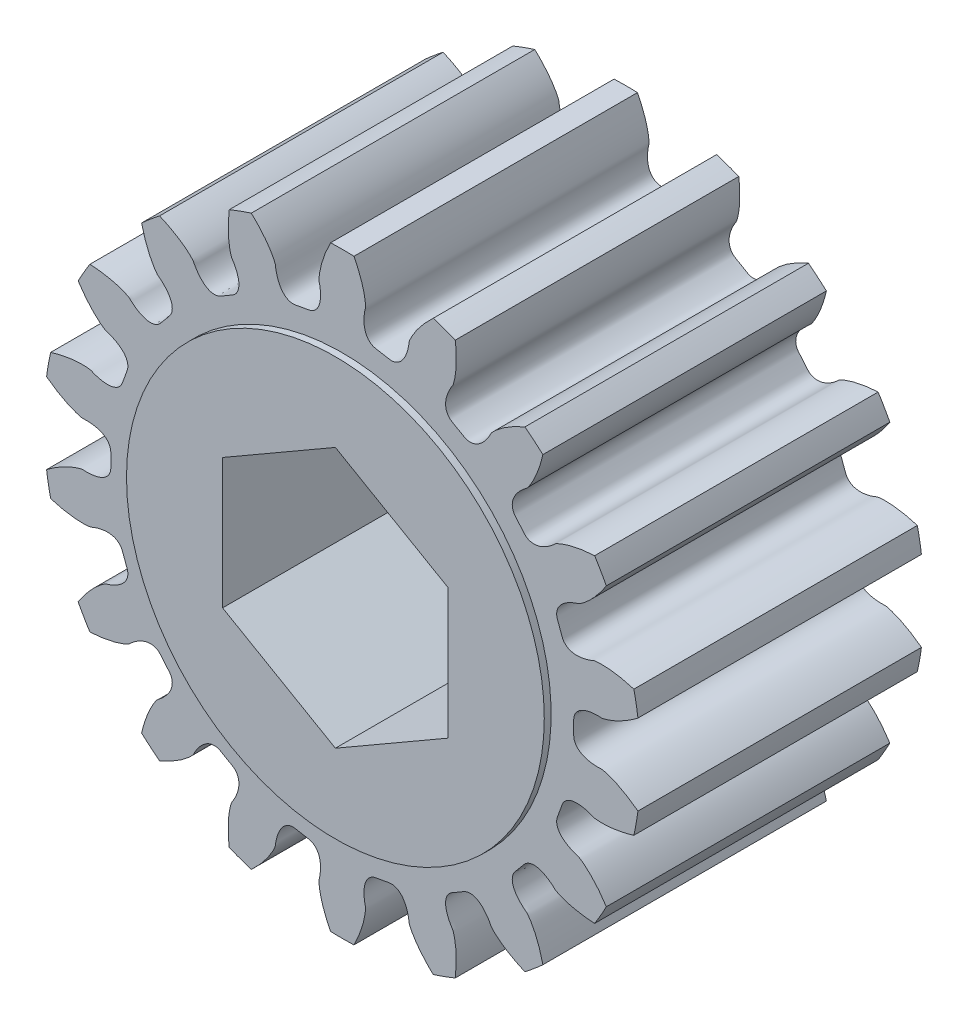
from build123d import *

# Parameters (mm, degrees)
BOSS_EXTRUDE1_DEPTH = 12.065
SKETCH2_R           = 8.89
BOSS_EXTRUDE2_DEPTH = 0.2921
BOSS_EXTRUDE3_START = 0.2921
SKETCH3_R           = 8.89
BOSS_EXTRUDE3_DEPTH = 0.2921
CUT_EXTRUDE1_DEPTH  = 22.900846166


with BuildPart() as part:
    # Sketch1 → Boss-Extrude1 (new body)
    with BuildSketch(Plane.XY.offset(6.0325)):
        with BuildLine():
            ThreePointArc((12.410970883, -2.694030306), (12.507058369, -2.205331838), (12.583910389, -1.713241638))
            add(Edge.make_bspline(
                [(12.583910389, -1.713241638), (12.454495513, -1.615266365), (12.281691884, -1.494600081), (12.063530587, -1.360821083), (11.945634884, -1.293014345), (11.833605036, -1.232708673), (11.727763905, -1.179517154), (11.628417021, -1.133040061), (11.535852234, -1.09286743), (11.450339429, -1.058575143), (11.372129731, -1.029740178), (11.301456539, -1.005894736), (11.238530851, -0.986673766), (11.183554417, -0.971362731), (11.126066888, -0.957744243), (11.037383924, -0.935500863), (10.935383555, -0.952855993), (10.832757273, -0.948980949), (10.755684694, -0.945835715), (10.681454151, -0.939599556), (10.609986165, -0.931080188), (10.541241018, -0.920104184), (10.475144099, -0.906715101), (10.411601978, -0.890856967), (10.350496087, -0.872438809), (10.291684118, -0.851296022), (10.23500406, -0.827170041), (10.180287123, -0.799673241), (10.127386898, -0.768246797), (10.076238411, -0.732113156), (10.026966573, -0.690238537), (9.98006979, -0.641341891), (9.936675165, -0.584030203), (9.898843597, -0.517153755), (9.869552788, -0.440522263), (9.854050846, -0.362318712), (9.847049326, -0.214546824), (9.861767648, -5e-09), (9.847049326, 0.214546814), (9.854050846, 0.362318702), (9.869552789, 0.440522252), (9.898843597, 0.517153744), (9.936675165, 0.584030193), (9.980069791, 0.641341881), (10.026966574, 0.690238527), (10.076238412, 0.732113146), (10.127386899, 0.768246787), (10.180287124, 0.79967323), (10.235004061, 0.82717003), (10.291684119, 0.851296011), (10.350496088, 0.872438798), (10.411601979, 0.890856956), (10.4751441, 0.90671509), (10.541241019, 0.920104174), (10.609986166, 0.931080178), (10.681454152, 0.939599545), (10.755684695, 0.945835704), (10.832757274, 0.948980938), (10.935383556, 0.952855982), (11.037383925, 0.935500852), (11.126066889, 0.957744232), (11.183554418, 0.97136272), (11.238530852, 0.986673755), (11.30145654, 1.005894724), (11.372129732, 1.029740166), (11.45033943, 1.058575132), (11.535852235, 1.092867418), (11.628417022, 1.133040049), (11.727763907, 1.179517142), (11.833605037, 1.23270866), (11.945634885, 1.293014333), (12.063530588, 1.360821071), (12.281691885, 1.494600068), (12.454495515, 1.615266353), (12.58391039, 1.713241625)],
                knots=[0, 0, 0, 0, 0.068568258, 0.088954796, 0.108105787, 0.12602123, 0.142701125, 0.158145472, 0.172354272, 0.185327523, 0.197065227, 0.207567384, 0.216833992, 0.224865053, 0.231660567, 0.241835881, 0.263155637, 0.274398239, 0.285253325, 0.295735543, 0.30586243, 0.315655123, 0.325139277, 0.334346238, 0.343314557, 0.352091904, 0.360737466, 0.369324816, 0.377945084, 0.386709838, 0.395752205, 0.405223204, 0.415278018, 0.42604547, 0.437577809, 0.44979349, 0.459544035, 0.500000005, 0.540455975, 0.550206519, 0.5624222, 0.573954539, 0.584721991, 0.594776805, 0.604247805, 0.613290172, 0.622054925, 0.630675194, 0.639262544, 0.647908106, 0.656685453, 0.665653771, 0.674860733, 0.684344886, 0.69413758, 0.704264467, 0.714746685, 0.725601771, 0.736844372, 0.758164128, 0.768339443, 0.775134956, 0.783166017, 0.792432626, 0.802934782, 0.814672486, 0.827645738, 0.841854537, 0.857298885, 0.87397878, 0.891894222, 0.911045213, 0.931431751, 1.000000005, 1.000000005, 1.000000005, 1.000000005], degree=3))
            ThreePointArc((12.58391039, 1.713241625), (12.507058371, 2.205331832), (12.410970883, 2.694030306))
            add(Edge.make_bspline(
                [(12.410970883, 2.694030306), (12.255851163, 2.741834452), (12.052198568, 2.796121347), (11.801438895, 2.847216926), (11.667461903, 2.870611712), (11.541562526, 2.888964043), (11.423911826, 2.902747921), (11.31466019, 2.912443467), (11.213937893, 2.91853437), (11.121853489, 2.921511477), (11.038498274, 2.921858189), (10.963931576, 2.92009392), (10.898226812, 2.91663387), (10.84132918, 2.912218489), (10.782650776, 2.905353789), (10.691708366, 2.895924368), (10.601795176, 2.8447297), (10.504032672, 2.813270795), (10.430532405, 2.789865973), (10.35864562, 2.770337704), (10.288573885, 2.7538998), (10.220220564, 2.740701645), (10.153530441, 2.730676791), (10.088396577, 2.723845877), (10.024676441, 2.720253838), (9.962180009, 2.720006681), (9.900666605, 2.723291966), (9.839845043, 2.730416211), (9.779386616, 2.741854465), (9.718964327, 2.758315169), (9.658341981, 2.780812478), (9.597549782, 2.810720651), (9.537170421, 2.849734185), (9.478747284, 2.899638332), (9.425013413, 2.961630333), (9.383699162, 3.029815656), (9.326578923, 3.166281147), (9.267030288, 3.372923173), (9.179820255, 3.569497273), (9.13585857, 3.710752086), (9.123678441, 3.789541362), (9.124993284, 3.871569456), (9.137670236, 3.94735192), (9.158846094, 4.016049126), (9.186191017, 4.078036588), (9.218169437, 4.13423782), (9.253874859, 4.185686149), (9.292836333, 4.233310288), (9.334848976, 4.277863123), (9.379859237, 4.319919851), (9.427893151, 4.359902449), (9.479014525, 4.398109302), (9.533300786, 4.434743759), (9.590832237, 4.46993186), (9.651677529, 4.503758155), (9.715921673, 4.536207233), (9.783542674, 4.567455646), (9.854891475, 4.596771573), (9.950003292, 4.63551318), (10.05178809, 4.654090873), (10.127515133, 4.705324173), (10.176877942, 4.737783259), (10.223302209, 4.770973973), (10.275859055, 4.810557629), (10.33411451, 4.85713667), (10.397745447, 4.910981967), (10.466372546, 4.972453278), (10.539615145, 5.041862224), (10.617074577, 5.119515041), (10.698340136, 5.205698517), (10.782988003, 5.300683777), (10.870582454, 5.404723974), (11.029831903, 5.605050669), (11.150943898, 5.777542208), (11.239044585, 5.913871343)],
                knots=[0, 0, 0, 0, 0.068568258, 0.088954796, 0.108105787, 0.12602123, 0.142701125, 0.158145472, 0.172354272, 0.185327523, 0.197065227, 0.207567384, 0.216833992, 0.224865053, 0.231660567, 0.241835881, 0.263155637, 0.274398239, 0.285253325, 0.295735543, 0.30586243, 0.315655123, 0.325139277, 0.334346238, 0.343314557, 0.352091904, 0.360737466, 0.369324816, 0.377945084, 0.386709838, 0.395752205, 0.405223204, 0.415278018, 0.42604547, 0.437577809, 0.44979349, 0.459544035, 0.500000005, 0.540455975, 0.550206519, 0.5624222, 0.573954539, 0.584721991, 0.594776805, 0.604247805, 0.613290172, 0.622054925, 0.630675194, 0.639262544, 0.647908106, 0.656685453, 0.665653771, 0.674860733, 0.684344886, 0.69413758, 0.704264467, 0.714746685, 0.725601771, 0.736844372, 0.758164128, 0.768339443, 0.775134956, 0.783166017, 0.792432626, 0.802934782, 0.814672486, 0.827645738, 0.841854537, 0.857298885, 0.87397878, 0.891894222, 0.911045213, 0.931431751, 1.000000005, 1.000000005, 1.000000005, 1.000000005], degree=3))
            ThreePointArc((11.239044585, 5.913871343), (10.998522549, 6.349999934), (10.741085127, 6.776362423))
            add(Edge.make_bspline(
                [(10.741085127, 6.776362423), (10.57897029, 6.768229557), (10.369032237, 6.749589262), (10.115919506, 6.711838541), (9.982020827, 6.687999619), (9.857437245, 6.662185046), (9.742167386, 6.634898745), (9.636188358, 6.606643318), (9.539457148, 6.57791784), (9.451907882, 6.549220684), (9.373461019, 6.521037324), (9.303994658, 6.493876141), (9.243435784, 6.468152405), (9.191479648, 6.444543168), (9.138687851, 6.418023263), (9.05645499, 6.378058371), (8.989473837, 6.299198996), (8.908366713, 6.23620055), (8.847303975, 6.189068639), (8.786431555, 6.146131341), (8.726207757, 6.106718819), (8.66649068, 6.070938398), (8.607251166, 6.03870875), (8.548381665, 6.010012697), (8.489732872, 5.984843715), (8.431089969, 5.963236424), (8.372162644, 5.945284759), (8.312572436, 5.931177161), (8.251847984, 5.921247604), (8.189439713, 5.916049966), (8.124778809, 5.916456458), (8.057423631, 5.92376879), (7.987342176, 5.939778563), (7.915374162, 5.966691232), (7.843678327, 6.006566591), (7.781534876, 6.05650953), (7.681185462, 6.165208873), (7.554552314, 6.339022027), (7.405369388, 6.49391367), (7.315746925, 6.611613994), (7.277353829, 6.681485846), (7.250534116, 6.759016743), (7.236527426, 6.834564738), (7.232930395, 6.906361566), (7.237425257, 6.97396324), (7.248253188, 7.037712387), (7.264208945, 7.098269976), (7.28453234, 7.156347637), (7.308773343, 7.212582777), (7.336684905, 7.26749759), (7.368147166, 7.321497509), (7.40311803, 7.374884747), (7.441600707, 7.42787687), (7.483627548, 7.480619784), (7.529234146, 7.533216419), (7.578505655, 7.58568137), (7.631361024, 7.638173018), (7.688380328, 7.690123705), (7.764505791, 7.759059064), (7.85379827, 7.811328837), (7.907435592, 7.885372565), (7.942719799, 7.932757203), (7.974992447, 7.979824307), (8.010841319, 8.034996277), (8.04965257, 8.098690797), (8.091029917, 8.171051887), (8.134493868, 8.252287874), (8.17958014, 8.342561393), (8.225809369, 8.442023858), (8.27269753, 8.550804293), (8.319753634, 8.669012516), (8.36648165, 8.796737388), (8.447611417, 9.039449425), (8.502423885, 9.242961193), (8.53858414, 9.401200885)],
                knots=[0, 0, 0, 0, 0.068568258, 0.088954796, 0.108105787, 0.12602123, 0.142701125, 0.158145472, 0.172354272, 0.185327523, 0.197065227, 0.207567384, 0.216833992, 0.224865053, 0.231660567, 0.241835881, 0.263155637, 0.274398239, 0.285253325, 0.295735543, 0.30586243, 0.315655123, 0.325139277, 0.334346238, 0.343314557, 0.352091904, 0.360737466, 0.369324816, 0.377945084, 0.386709838, 0.395752205, 0.405223204, 0.415278018, 0.42604547, 0.437577809, 0.44979349, 0.459544035, 0.500000005, 0.540455975, 0.550206519, 0.5624222, 0.573954539, 0.584721991, 0.594776805, 0.604247805, 0.613290172, 0.622054925, 0.630675194, 0.639262544, 0.647908106, 0.656685453, 0.665653771, 0.674860733, 0.684344886, 0.69413758, 0.704264467, 0.714746685, 0.725601771, 0.736844372, 0.758164128, 0.768339443, 0.775134956, 0.783166017, 0.792432626, 0.802934782, 0.814672486, 0.827645738, 0.841854537, 0.857298885, 0.87397878, 0.891894222, 0.911045213, 0.931431751, 1.000000005, 1.000000005, 1.000000005, 1.000000005], degree=3))
            ThreePointArc((8.53858414, 9.401200885), (8.163402594, 9.728764322), (7.775665989, 10.041365223))
            add(Edge.make_bspline(
                [(7.775665989, 10.041365223), (7.626109477, 9.978276289), (7.435207594, 9.888957098), (7.210270936, 9.766913371), (7.092600726, 9.698716067), (6.984359558, 9.631848209), (6.885373786, 9.56678286), (6.795450001, 9.503984481), (6.714377089, 9.443907339), (6.641922695, 9.386997221), (6.577846033, 9.333683118), (6.521858679, 9.28440106), (6.473749987, 9.2395163), (6.433002025, 9.199560829), (6.392464304, 9.156584413), (6.32885949, 9.090904403), (6.292889289, 8.993891927), (6.238220261, 8.906952482), (6.196960119, 8.841778287), (6.154444176, 8.780610831), (6.111332194, 8.722977423), (6.067454122, 8.668930382), (6.022810376, 8.618383312), (5.977305769, 8.571283288), (5.93080223, 8.527573113), (5.883086055, 8.487211847), (5.833852314, 8.450188467), (5.782680918, 8.41655061), (5.729014708, 8.386450893), (5.672147813, 8.360221825), (5.61124741, 8.338488471), (5.545453281, 8.322322988), (5.47412259, 8.313397984), (5.397290103, 8.31407311), (5.31627988, 8.327022271), (5.240802647, 8.352698971), (5.109327678, 8.42052142), (4.930883844, 8.54054127), (4.737721687, 8.635068239), (4.613248238, 8.715017677), (4.553272948, 8.767544528), (4.501553533, 8.831226859), (4.462552614, 8.897428182), (4.434616549, 8.963664873), (4.415719203, 9.028727002), (4.404090638, 9.092334975), (4.39837223, 9.154697685), (4.397606244, 9.216223845), (4.401151785, 9.277358502), (4.408598102, 9.338507863), (4.419693896, 9.400011916), (4.434296249, 9.462140249), (4.452333762, 9.525098407), (4.473786935, 9.58903456), (4.49865401, 9.654057605), (4.527010014, 9.720210381), (4.558724614, 9.787613996), (4.594537051, 9.855933424), (4.642494306, 9.946747914), (4.708524474, 10.02640526), (4.733602623, 10.114328649), (4.750552431, 10.170923554), (4.764780903, 10.22619006), (4.779597899, 10.290295789), (4.794283736, 10.363423289), (4.808416773, 10.445572357), (4.821475183, 10.536774762), (4.832967058, 10.637024535), (4.842390157, 10.746300007), (4.849245516, 10.864556874), (4.853034196, 10.991730405), (4.853259689, 11.127734447), (4.846484327, 11.383557171), (4.828386074, 11.593542647), (4.808244437, 11.754606853)],
                knots=[0, 0, 0, 0, 0.068568258, 0.088954796, 0.108105787, 0.12602123, 0.142701125, 0.158145472, 0.172354272, 0.185327523, 0.197065227, 0.207567384, 0.216833992, 0.224865053, 0.231660567, 0.241835881, 0.263155637, 0.274398239, 0.285253325, 0.295735543, 0.30586243, 0.315655123, 0.325139277, 0.334346238, 0.343314557, 0.352091904, 0.360737466, 0.369324816, 0.377945084, 0.386709838, 0.395752205, 0.405223204, 0.415278018, 0.42604547, 0.437577809, 0.44979349, 0.459544035, 0.500000005, 0.540455975, 0.550206519, 0.5624222, 0.573954539, 0.584721991, 0.594776805, 0.604247805, 0.613290172, 0.622054925, 0.630675194, 0.639262544, 0.647908106, 0.656685453, 0.665653771, 0.674860733, 0.684344886, 0.69413758, 0.704264467, 0.714746685, 0.725601771, 0.736844372, 0.758164128, 0.768339443, 0.775134956, 0.783166017, 0.792432626, 0.802934782, 0.814672486, 0.827645738, 0.841854537, 0.857298885, 0.87397878, 0.891894222, 0.911045213, 0.931431751, 1.000000005, 1.000000005, 1.000000005, 1.000000005], degree=3))
            ThreePointArc((4.808244437, 11.754606853), (4.343655813, 11.934096152), (3.872386782, 12.095231182))
            add(Edge.make_bspline(
                [(3.872386782, 12.095231182), (3.753427317, 11.984795637), (3.604587189, 11.835570763), (3.434957284, 11.643954305), (3.347708308, 11.53962422), (3.268865036, 11.439768327), (3.198102496, 11.344771771), (3.13508009, 11.255004851), (3.079444065, 11.170822235), (3.030823612, 11.092563355), (2.988845743, 11.020548977), (2.953090296, 10.955090188), (2.923234405, 10.896458169), (2.898609422, 10.844975684), (2.875215224, 10.790726345), (2.837910136, 10.707253197), (2.837289425, 10.603788756), (2.815652384, 10.503394492), (2.799171421, 10.428038982), (2.780140005, 10.356019066), (2.75933978, 10.287116212), (2.736593057, 10.221321422), (2.711929774, 10.158553653), (2.685278587, 10.098730616), (2.656529316, 10.04175134), (2.625495144, 9.987504263), (2.591893302, 9.935874735), (2.555312744, 9.886763841), (2.515177711, 9.840124434), (2.47071118, 9.796027549), (2.420916765, 9.754775711), (2.364619428, 9.717082209), (2.300643036, 9.684298916), (2.228213209, 9.658655068), (2.147659626, 9.643116171), (2.067952278, 9.641429642), (1.921209576, 9.66019481), (1.712478015, 9.711945192), (1.498634835, 9.734706138), (1.354323736, 9.767261608), (1.280000156, 9.796107945), (1.209619164, 9.83826068), (1.150328102, 9.887130474), (1.101422505, 9.939817908), (1.06141225, 9.994493037), (1.028729765, 10.050287777), (1.002026917, 10.106933744), (0.980263939, 10.16448744), (0.962686374, 10.223147873), (0.948769309, 10.283156266), (0.93816032, 10.344746156), (0.930632902, 10.408121991), (0.926049662, 10.4734525), (0.924341599, 10.540870249), (0.925469814, 10.610476965), (0.92949016, 10.682338565), (0.936238741, 10.756524276), (0.946524804, 10.832972114), (0.960529497, 10.934712167), (0.995333141, 11.032149235), (0.988827324, 11.123347427), (0.985398336, 11.182326417), (0.979866467, 11.239126369), (0.971864438, 11.30443376), (0.960653533, 11.378173985), (0.945837607, 11.460202641), (0.92691544, 11.550371108), (0.903426828, 11.648505532), (0.874907232, 11.754413776), (0.840902932, 11.867883553), (0.800967217, 11.988683386), (0.754662989, 12.116562504), (0.660799707, 12.35463992), (0.571973649, 12.545771754), (0.497959499, 12.690233755)],
                knots=[0, 0, 0, 0, 0.068568258, 0.088954796, 0.108105787, 0.12602123, 0.142701125, 0.158145472, 0.172354272, 0.185327523, 0.197065227, 0.207567384, 0.216833992, 0.224865053, 0.231660567, 0.241835881, 0.263155637, 0.274398239, 0.285253325, 0.295735543, 0.30586243, 0.315655123, 0.325139277, 0.334346238, 0.343314557, 0.352091904, 0.360737466, 0.369324816, 0.377945084, 0.386709838, 0.395752205, 0.405223204, 0.415278018, 0.42604547, 0.437577809, 0.44979349, 0.459544035, 0.500000005, 0.540455975, 0.550206519, 0.5624222, 0.573954539, 0.584721991, 0.594776805, 0.604247805, 0.613290172, 0.622054925, 0.630675194, 0.639262544, 0.647908106, 0.656685453, 0.665653771, 0.674860733, 0.684344886, 0.69413758, 0.704264467, 0.714746685, 0.725601771, 0.736844372, 0.758164128, 0.768339443, 0.775134956, 0.783166017, 0.792432626, 0.802934782, 0.814672486, 0.827645738, 0.841854537, 0.857298885, 0.87397878, 0.891894222, 0.911045213, 0.931431751, 1.000000005, 1.000000005, 1.000000005, 1.000000005], degree=3))
            ThreePointArc((0.497959499, 12.690233755), (4.2e-08, 12.699999857), (-0.497959416, 12.690233754))
            add(Edge.make_bspline(
                [(-0.497959416, 12.690233754), (-0.571973566, 12.545771754), (-0.660799623, 12.354639919), (-0.754662905, 12.116562503), (-0.800967133, 11.988683385), (-0.840902847, 11.867883552), (-0.874907148, 11.754413776), (-0.903426744, 11.648505531), (-0.926915355, 11.550371107), (-0.945837523, 11.46020264), (-0.960653449, 11.378173984), (-0.971864354, 11.304433759), (-0.979866382, 11.239126368), (-0.985398251, 11.182326416), (-0.988827239, 11.123347426), (-0.995333057, 11.032149233), (-0.960529412, 10.934712166), (-0.946524718, 10.832972113), (-0.936238656, 10.756524275), (-0.929490075, 10.682338564), (-0.925469729, 10.610476964), (-0.924341513, 10.540870248), (-0.926049577, 10.473452499), (-0.930632816, 10.40812199), (-0.938160235, 10.344746155), (-0.948769224, 10.283156265), (-0.962686288, 10.223147872), (-0.980263854, 10.164487439), (-1.002026831, 10.106933743), (-1.028729679, 10.050287776), (-1.061412164, 9.994493036), (-1.101422419, 9.939817907), (-1.150328016, 9.887130473), (-1.209619078, 9.838260679), (-1.28000007, 9.796107944), (-1.354323649, 9.767261607), (-1.498634749, 9.734706137), (-1.712477929, 9.71194519), (-1.92120949, 9.660194808), (-2.067952192, 9.64142964), (-2.147659539, 9.643116169), (-2.228213122, 9.658655066), (-2.30064295, 9.684298913), (-2.364619342, 9.717082207), (-2.420916679, 9.754775709), (-2.470711094, 9.796027546), (-2.515177625, 9.840124431), (-2.555312658, 9.886763838), (-2.591893216, 9.935874733), (-2.625495058, 9.987504261), (-2.65652923, 10.041751337), (-2.685278501, 10.098730613), (-2.711929688, 10.158553651), (-2.736592971, 10.221321419), (-2.759339694, 10.287116209), (-2.78013992, 10.356019063), (-2.799171336, 10.42803898), (-2.815652299, 10.503394489), (-2.837289339, 10.603788753), (-2.837910051, 10.707253194), (-2.875215139, 10.790726342), (-2.898609336, 10.844975681), (-2.92323432, 10.896458166), (-2.953090211, 10.955090185), (-2.988845658, 11.020548974), (-3.030823527, 11.092563352), (-3.07944398, 11.170822232), (-3.135080005, 11.255004848), (-3.198102412, 11.344771768), (-3.268864951, 11.439768323), (-3.347708224, 11.539624216), (-3.434957199, 11.643954302), (-3.604587105, 11.835570759), (-3.753427233, 11.984795633), (-3.872386698, 12.095231178)],
                knots=[0, 0, 0, 0, 0.068568258, 0.088954796, 0.108105787, 0.12602123, 0.142701125, 0.158145472, 0.172354272, 0.185327523, 0.197065227, 0.207567384, 0.216833992, 0.224865053, 0.231660567, 0.241835881, 0.263155637, 0.274398239, 0.285253325, 0.295735543, 0.30586243, 0.315655123, 0.325139277, 0.334346238, 0.343314557, 0.352091904, 0.360737466, 0.369324816, 0.377945084, 0.386709838, 0.395752205, 0.405223204, 0.415278018, 0.42604547, 0.437577809, 0.44979349, 0.459544035, 0.500000005, 0.540455975, 0.550206519, 0.5624222, 0.573954539, 0.584721991, 0.594776805, 0.604247805, 0.613290172, 0.622054925, 0.630675194, 0.639262544, 0.647908106, 0.656685453, 0.665653771, 0.674860733, 0.684344886, 0.69413758, 0.704264467, 0.714746685, 0.725601771, 0.736844372, 0.758164128, 0.768339443, 0.775134956, 0.783166017, 0.792432626, 0.802934782, 0.814672486, 0.827645738, 0.841854537, 0.857298885, 0.87397878, 0.891894222, 0.911045213, 0.931431751, 1.000000005, 1.000000005, 1.000000005, 1.000000005], degree=3))
            ThreePointArc((-3.872386698, 12.095231178), (-4.343655729, 11.934096147), (-4.808244353, 11.754606848))
            add(Edge.make_bspline(
                [(-4.808244353, 11.754606848), (-4.82838599, 11.593542642), (-4.846484243, 11.383557166), (-4.853259604, 11.127734442), (-4.853034111, 10.9917304), (-4.849245431, 10.864556869), (-4.842390072, 10.746300002), (-4.832966973, 10.63702453), (-4.821475098, 10.536774757), (-4.808416687, 10.445572352), (-4.794283651, 10.363423284), (-4.779597813, 10.290295784), (-4.764780817, 10.226190055), (-4.750552345, 10.170923549), (-4.733602538, 10.114328644), (-4.708524388, 10.026405255), (-4.64249422, 9.946747909), (-4.594536965, 9.855933419), (-4.558724527, 9.787613991), (-4.527009928, 9.720210376), (-4.498653924, 9.6540576), (-4.473786849, 9.589034555), (-4.452333676, 9.525098402), (-4.434296162, 9.462140244), (-4.419693809, 9.400011911), (-4.408598015, 9.338507859), (-4.401151699, 9.277358498), (-4.397606157, 9.21622384), (-4.398372143, 9.15469768), (-4.404090551, 9.092334971), (-4.415719116, 9.028726997), (-4.434616462, 8.963664869), (-4.462552527, 8.897428177), (-4.501553446, 8.831226854), (-4.553272861, 8.767544524), (-4.613248151, 8.715017672), (-4.7377216, 8.635068234), (-4.930883756, 8.540541265), (-5.109327591, 8.420521415), (-5.240802559, 8.352698965), (-5.316279792, 8.327022266), (-5.397290015, 8.314073104), (-5.474122503, 8.313397978), (-5.545453193, 8.322322982), (-5.611247322, 8.338488465), (-5.672147725, 8.360221819), (-5.72901462, 8.386450887), (-5.78268083, 8.416550604), (-5.833852226, 8.450188461), (-5.883085968, 8.487211841), (-5.930802143, 8.527573107), (-5.977305681, 8.571283282), (-6.022810289, 8.618383306), (-6.067454035, 8.668930375), (-6.111332106, 8.722977417), (-6.154444089, 8.780610824), (-6.196960032, 8.84177828), (-6.238220174, 8.906952475), (-6.292889201, 8.993891921), (-6.328859403, 9.090904397), (-6.392464217, 9.156584406), (-6.433001938, 9.199560823), (-6.4737499, 9.239516293), (-6.521858592, 9.284401053), (-6.577845946, 9.333683111), (-6.641922608, 9.386997214), (-6.714377002, 9.443907332), (-6.795449914, 9.503984474), (-6.8853737, 9.566782853), (-6.984359472, 9.631848201), (-7.09260064, 9.69871606), (-7.210270849, 9.766913364), (-7.435207508, 9.88895709), (-7.626109391, 9.978276281), (-7.775665903, 10.041365215)],
                knots=[0, 0, 0, 0, 0.068568258, 0.088954796, 0.108105787, 0.12602123, 0.142701125, 0.158145472, 0.172354272, 0.185327523, 0.197065227, 0.207567384, 0.216833992, 0.224865053, 0.231660567, 0.241835881, 0.263155637, 0.274398239, 0.285253325, 0.295735543, 0.30586243, 0.315655123, 0.325139277, 0.334346238, 0.343314557, 0.352091904, 0.360737466, 0.369324816, 0.377945084, 0.386709838, 0.395752205, 0.405223204, 0.415278018, 0.42604547, 0.437577809, 0.44979349, 0.459544035, 0.500000005, 0.540455975, 0.550206519, 0.5624222, 0.573954539, 0.584721991, 0.594776805, 0.604247805, 0.613290172, 0.622054925, 0.630675194, 0.639262544, 0.647908106, 0.656685453, 0.665653771, 0.674860733, 0.684344886, 0.69413758, 0.704264467, 0.714746685, 0.725601771, 0.736844372, 0.758164128, 0.768339443, 0.775134956, 0.783166017, 0.792432626, 0.802934782, 0.814672486, 0.827645738, 0.841854537, 0.857298885, 0.87397878, 0.891894222, 0.911045213, 0.931431751, 1.000000005, 1.000000005, 1.000000005, 1.000000005], degree=3))
            ThreePointArc((-7.775665903, 10.041365215), (-8.163402508, 9.728764314), (-8.538584053, 9.401200876))
            add(Edge.make_bspline(
                [(-8.538584053, 9.401200876), (-8.502423798, 9.242961184), (-8.44761133, 9.039449416), (-8.366481563, 8.79673738), (-8.319753546, 8.669012508), (-8.272697442, 8.550804284), (-8.225809282, 8.44202385), (-8.179580052, 8.342561384), (-8.13449378, 8.252287866), (-8.091029829, 8.171051878), (-8.049652482, 8.098690788), (-8.010841231, 8.034996268), (-7.974992359, 7.979824299), (-7.942719711, 7.932757195), (-7.907435504, 7.885372557), (-7.853798181, 7.811328829), (-7.764505703, 7.759059056), (-7.68838024, 7.690123697), (-7.631360936, 7.63817301), (-7.578505567, 7.585681362), (-7.529234057, 7.533216411), (-7.483627459, 7.480619776), (-7.441600618, 7.427876863), (-7.403117941, 7.374884739), (-7.368147077, 7.321497502), (-7.336684816, 7.267497582), (-7.308773254, 7.21258277), (-7.284532251, 7.15634763), (-7.264208856, 7.098269968), (-7.248253099, 7.03771238), (-7.237425168, 6.973963233), (-7.232930305, 6.906361558), (-7.236527337, 6.834564731), (-7.250534027, 6.759016736), (-7.277353739, 6.681485838), (-7.315746836, 6.611613986), (-7.405369299, 6.493913663), (-7.554552225, 6.339022019), (-7.681185372, 6.165208865), (-7.781534786, 6.056509522), (-7.843678237, 6.006566583), (-7.915374072, 5.966691223), (-7.987342086, 5.939778555), (-8.057423541, 5.923768782), (-8.124778719, 5.916456449), (-8.189439623, 5.916049957), (-8.251847894, 5.921247596), (-8.312572346, 5.931177152), (-8.372162554, 5.94528475), (-8.431089879, 5.963236416), (-8.489732782, 5.984843706), (-8.548381574, 6.010012688), (-8.607251076, 6.038708741), (-8.66649059, 6.070938389), (-8.726207667, 6.10671881), (-8.786431465, 6.146131332), (-8.847303885, 6.18906863), (-8.908366623, 6.236200541), (-8.989473747, 6.299198987), (-9.056454901, 6.378058361), (-9.138687761, 6.418023254), (-9.191479559, 6.444543158), (-9.243435694, 6.468152395), (-9.303994569, 6.493876131), (-9.373460929, 6.521037315), (-9.451907792, 6.549220675), (-9.539457058, 6.57791783), (-9.636188269, 6.606643308), (-9.742167297, 6.634898735), (-9.857437156, 6.662185035), (-9.982020738, 6.687999609), (-10.115919417, 6.71183853), (-10.369032148, 6.749589251), (-10.578970201, 6.768229546), (-10.741085038, 6.776362412)],
                knots=[0, 0, 0, 0, 0.068568258, 0.088954796, 0.108105787, 0.12602123, 0.142701125, 0.158145472, 0.172354272, 0.185327523, 0.197065227, 0.207567384, 0.216833992, 0.224865053, 0.231660567, 0.241835881, 0.263155637, 0.274398239, 0.285253325, 0.295735543, 0.30586243, 0.315655123, 0.325139277, 0.334346238, 0.343314557, 0.352091904, 0.360737466, 0.369324816, 0.377945084, 0.386709838, 0.395752205, 0.405223204, 0.415278018, 0.42604547, 0.437577809, 0.44979349, 0.459544035, 0.500000005, 0.540455975, 0.550206519, 0.5624222, 0.573954539, 0.584721991, 0.594776805, 0.604247805, 0.613290172, 0.622054925, 0.630675194, 0.639262544, 0.647908106, 0.656685453, 0.665653771, 0.674860733, 0.684344886, 0.69413758, 0.704264467, 0.714746685, 0.725601771, 0.736844372, 0.758164128, 0.768339443, 0.775134956, 0.783166017, 0.792432626, 0.802934782, 0.814672486, 0.827645738, 0.841854537, 0.857298885, 0.87397878, 0.891894222, 0.911045213, 0.931431751, 1.000000005, 1.000000005, 1.000000005, 1.000000005], degree=3))
            ThreePointArc((-10.741085038, 6.776362412), (-10.998522459, 6.349999923), (-11.239044495, 5.913871331))
            add(Edge.make_bspline(
                [(-11.239044495, 5.913871331), (-11.150943808, 5.777542197), (-11.029831812, 5.605050658), (-10.870582363, 5.404723963), (-10.782987912, 5.300683766), (-10.698340045, 5.205698506), (-10.617074486, 5.11951503), (-10.539615054, 5.041862213), (-10.466372455, 4.972453267), (-10.397745356, 4.910981956), (-10.334114419, 4.85713666), (-10.275858964, 4.810557619), (-10.223302118, 4.770973963), (-10.176877851, 4.737783248), (-10.127515041, 4.705324163), (-10.051787999, 4.654090863), (-9.950003201, 4.635513169), (-9.854891383, 4.596771563), (-9.783542583, 4.567455636), (-9.715921582, 4.536207223), (-9.651677437, 4.503758145), (-9.590832145, 4.46993185), (-9.533300694, 4.434743749), (-9.479014433, 4.398109293), (-9.427893059, 4.35990244), (-9.379859145, 4.319919841), (-9.334848884, 4.277863113), (-9.292836241, 4.233310278), (-9.253874767, 4.185686139), (-9.218169345, 4.13423781), (-9.186190925, 4.078036578), (-9.158846002, 4.016049116), (-9.137670144, 3.94735191), (-9.124993192, 3.871569447), (-9.123678349, 3.789541353), (-9.135858477, 3.710752077), (-9.179820163, 3.569497263), (-9.267030195, 3.372923163), (-9.32657883, 3.166281138), (-9.383699069, 3.029815646), (-9.42501332, 2.961630323), (-9.47874719, 2.899638322), (-9.537170328, 2.849734175), (-9.597549689, 2.810720641), (-9.658341887, 2.780812468), (-9.718964234, 2.758315159), (-9.779386522, 2.741854455), (-9.83984495, 2.730416201), (-9.900666511, 2.723291955), (-9.962179915, 2.720006671), (-10.024676347, 2.720253828), (-10.088396483, 2.723845866), (-10.153530347, 2.73067678), (-10.220220471, 2.740701635), (-10.288573792, 2.75389979), (-10.358645527, 2.770337694), (-10.430532312, 2.789865962), (-10.504032579, 2.813270784), (-10.601795082, 2.844729689), (-10.691708273, 2.895924358), (-10.782650683, 2.905353778), (-10.841329087, 2.912218478), (-10.898226719, 2.916633859), (-10.963931482, 2.920093908), (-11.03849818, 2.921858178), (-11.121853396, 2.921511465), (-11.2139378, 2.918534358), (-11.314660097, 2.912443455), (-11.423911733, 2.90274791), (-11.541562433, 2.888964031), (-11.667461809, 2.8706117), (-11.801438801, 2.847216914), (-12.052198474, 2.796121335), (-12.25585107, 2.74183444), (-12.41097079, 2.694030294)],
                knots=[0, 0, 0, 0, 0.068568258, 0.088954796, 0.108105787, 0.12602123, 0.142701125, 0.158145472, 0.172354272, 0.185327523, 0.197065227, 0.207567384, 0.216833992, 0.224865053, 0.231660567, 0.241835881, 0.263155637, 0.274398239, 0.285253325, 0.295735543, 0.30586243, 0.315655123, 0.325139277, 0.334346238, 0.343314557, 0.352091904, 0.360737466, 0.369324816, 0.377945084, 0.386709838, 0.395752205, 0.405223204, 0.415278018, 0.42604547, 0.437577809, 0.44979349, 0.459544035, 0.500000005, 0.540455975, 0.550206519, 0.5624222, 0.573954539, 0.584721991, 0.594776805, 0.604247805, 0.613290172, 0.622054925, 0.630675194, 0.639262544, 0.647908106, 0.656685453, 0.665653771, 0.674860733, 0.684344886, 0.69413758, 0.704264467, 0.714746685, 0.725601771, 0.736844372, 0.758164128, 0.768339443, 0.775134956, 0.783166017, 0.792432626, 0.802934782, 0.814672486, 0.827645738, 0.841854537, 0.857298885, 0.87397878, 0.891894222, 0.911045213, 0.931431751, 1.000000005, 1.000000005, 1.000000005, 1.000000005], degree=3))
            ThreePointArc((-12.41097079, 2.694030294), (-12.507058275, 2.205331828), (-12.583910293, 1.713241631))
            add(Edge.make_bspline(
                [(-12.583910293, 1.713241631), (-12.454495418, 1.615266359), (-12.281691788, 1.494600075), (-12.063530491, 1.360821077), (-11.945634789, 1.293014339), (-11.83360494, 1.232708667), (-11.72776381, 1.179517148), (-11.628416925, 1.133040055), (-11.535852138, 1.092867424), (-11.450339333, 1.058575137), (-11.372129635, 1.029740172), (-11.301456443, 1.00589473), (-11.238530755, 0.986673761), (-11.183554321, 0.971362725), (-11.126066792, 0.957744237), (-11.037383829, 0.935500858), (-10.93538346, 0.952855987), (-10.832757177, 0.948980943), (-10.755684598, 0.94583571), (-10.681454055, 0.939599551), (-10.609986069, 0.931080183), (-10.541240923, 0.920104179), (-10.475144003, 0.906715096), (-10.411601882, 0.890856962), (-10.350495991, 0.872438803), (-10.291684022, 0.851296017), (-10.235003964, 0.827170036), (-10.180287027, 0.799673236), (-10.127386802, 0.768246792), (-10.076238316, 0.732113151), (-10.026966477, 0.690238532), (-9.980069694, 0.641341886), (-9.936675069, 0.584030198), (-9.898843501, 0.51715375), (-9.869552692, 0.440522258), (-9.85405075, 0.362318707), (-9.84704923, 0.214546819), (-9.861767552, 0), (-9.84704923, -0.214546819), (-9.85405075, -0.362318707), (-9.869552692, -0.440522258), (-9.898843501, -0.51715375), (-9.936675069, -0.584030198), (-9.980069694, -0.641341886), (-10.026966477, -0.690238532), (-10.076238316, -0.732113151), (-10.127386802, -0.768246792), (-10.180287027, -0.799673236), (-10.235003964, -0.827170036), (-10.291684022, -0.851296017), (-10.350495991, -0.872438803), (-10.411601882, -0.890856962), (-10.475144003, -0.906715096), (-10.541240923, -0.920104179), (-10.609986069, -0.931080183), (-10.681454055, -0.939599551), (-10.755684598, -0.94583571), (-10.832757177, -0.948980943), (-10.93538346, -0.952855987), (-11.037383829, -0.935500858), (-11.126066792, -0.957744237), (-11.183554321, -0.971362725), (-11.238530755, -0.986673761), (-11.301456443, -1.00589473), (-11.372129635, -1.029740172), (-11.450339333, -1.058575137), (-11.535852138, -1.092867424), (-11.628416925, -1.133040055), (-11.72776381, -1.179517148), (-11.83360494, -1.232708667), (-11.945634789, -1.293014339), (-12.063530491, -1.360821077), (-12.281691788, -1.494600075), (-12.454495418, -1.615266359), (-12.583910293, -1.713241631)],
                knots=[0, 0, 0, 0, 0.068568258, 0.088954796, 0.108105787, 0.12602123, 0.142701125, 0.158145472, 0.172354272, 0.185327523, 0.197065227, 0.207567384, 0.216833992, 0.224865053, 0.231660567, 0.241835881, 0.263155637, 0.274398239, 0.285253325, 0.295735543, 0.30586243, 0.315655123, 0.325139277, 0.334346238, 0.343314557, 0.352091904, 0.360737466, 0.369324816, 0.377945084, 0.386709838, 0.395752205, 0.405223204, 0.415278018, 0.42604547, 0.437577809, 0.44979349, 0.459544035, 0.500000005, 0.540455975, 0.550206519, 0.5624222, 0.573954539, 0.584721991, 0.594776805, 0.604247805, 0.613290172, 0.622054925, 0.630675194, 0.639262544, 0.647908106, 0.656685453, 0.665653771, 0.674860733, 0.684344886, 0.69413758, 0.704264467, 0.714746685, 0.725601771, 0.736844372, 0.758164128, 0.768339443, 0.775134956, 0.783166017, 0.792432626, 0.802934782, 0.814672486, 0.827645738, 0.841854537, 0.857298885, 0.87397878, 0.891894222, 0.911045213, 0.931431751, 1.000000005, 1.000000005, 1.000000005, 1.000000005], degree=3))
            ThreePointArc((-12.583910293, -1.713241631), (-12.507058275, -2.205331828), (-12.41097079, -2.694030294))
            add(Edge.make_bspline(
                [(-12.41097079, -2.694030294), (-12.25585107, -2.74183444), (-12.052198474, -2.796121335), (-11.801438801, -2.847216914), (-11.667461809, -2.8706117), (-11.541562433, -2.888964031), (-11.423911733, -2.90274791), (-11.314660097, -2.912443455), (-11.2139378, -2.918534358), (-11.121853396, -2.921511465), (-11.03849818, -2.921858178), (-10.963931482, -2.920093908), (-10.898226719, -2.916633859), (-10.841329087, -2.912218478), (-10.782650683, -2.905353778), (-10.691708273, -2.895924358), (-10.601795082, -2.844729689), (-10.504032579, -2.813270784), (-10.430532312, -2.789865962), (-10.358645527, -2.770337694), (-10.288573792, -2.75389979), (-10.220220471, -2.740701635), (-10.153530347, -2.73067678), (-10.088396483, -2.723845866), (-10.024676347, -2.720253828), (-9.962179915, -2.720006671), (-9.900666511, -2.723291955), (-9.83984495, -2.730416201), (-9.779386522, -2.741854455), (-9.718964234, -2.758315159), (-9.658341887, -2.780812468), (-9.597549689, -2.810720641), (-9.537170328, -2.849734175), (-9.47874719, -2.899638322), (-9.42501332, -2.961630323), (-9.383699069, -3.029815646), (-9.32657883, -3.166281138), (-9.267030195, -3.372923163), (-9.179820163, -3.569497263), (-9.135858477, -3.710752077), (-9.123678349, -3.789541353), (-9.124993192, -3.871569447), (-9.137670144, -3.94735191), (-9.158846002, -4.016049116), (-9.186190925, -4.078036578), (-9.218169345, -4.13423781), (-9.253874767, -4.185686139), (-9.292836241, -4.233310278), (-9.334848884, -4.277863113), (-9.379859145, -4.319919841), (-9.427893059, -4.35990244), (-9.479014433, -4.398109293), (-9.533300694, -4.434743749), (-9.590832145, -4.46993185), (-9.651677437, -4.503758145), (-9.715921582, -4.536207223), (-9.783542583, -4.567455636), (-9.854891383, -4.596771563), (-9.950003201, -4.635513169), (-10.051787999, -4.654090863), (-10.127515041, -4.705324163), (-10.176877851, -4.737783248), (-10.223302118, -4.770973963), (-10.275858964, -4.810557619), (-10.334114419, -4.85713666), (-10.397745356, -4.910981956), (-10.466372455, -4.972453267), (-10.539615054, -5.041862213), (-10.617074486, -5.11951503), (-10.698340045, -5.205698506), (-10.782987912, -5.300683766), (-10.870582363, -5.404723963), (-11.029831812, -5.605050658), (-11.150943808, -5.777542197), (-11.239044495, -5.913871331)],
                knots=[0, 0, 0, 0, 0.068568258, 0.088954796, 0.108105787, 0.12602123, 0.142701125, 0.158145472, 0.172354272, 0.185327523, 0.197065227, 0.207567384, 0.216833992, 0.224865053, 0.231660567, 0.241835881, 0.263155637, 0.274398239, 0.285253325, 0.295735543, 0.30586243, 0.315655123, 0.325139277, 0.334346238, 0.343314557, 0.352091904, 0.360737466, 0.369324816, 0.377945084, 0.386709838, 0.395752205, 0.405223204, 0.415278018, 0.42604547, 0.437577809, 0.44979349, 0.459544035, 0.500000005, 0.540455975, 0.550206519, 0.5624222, 0.573954539, 0.584721991, 0.594776805, 0.604247805, 0.613290172, 0.622054925, 0.630675194, 0.639262544, 0.647908106, 0.656685453, 0.665653771, 0.674860733, 0.684344886, 0.69413758, 0.704264467, 0.714746685, 0.725601771, 0.736844372, 0.758164128, 0.768339443, 0.775134956, 0.783166017, 0.792432626, 0.802934782, 0.814672486, 0.827645738, 0.841854537, 0.857298885, 0.87397878, 0.891894222, 0.911045213, 0.931431751, 1.000000005, 1.000000005, 1.000000005, 1.000000005], degree=3))
            ThreePointArc((-11.239044495, -5.913871331), (-10.998522459, -6.349999923), (-10.741085038, -6.776362412))
            add(Edge.make_bspline(
                [(-10.741085038, -6.776362412), (-10.578970201, -6.768229546), (-10.369032148, -6.749589251), (-10.115919417, -6.71183853), (-9.982020738, -6.687999609), (-9.857437156, -6.662185035), (-9.742167297, -6.634898735), (-9.636188269, -6.606643308), (-9.539457058, -6.57791783), (-9.451907792, -6.549220675), (-9.373460929, -6.521037315), (-9.303994569, -6.493876131), (-9.243435694, -6.468152395), (-9.191479559, -6.444543158), (-9.138687761, -6.418023254), (-9.056454901, -6.378058361), (-8.989473747, -6.299198987), (-8.908366623, -6.236200541), (-8.847303885, -6.18906863), (-8.786431465, -6.146131332), (-8.726207667, -6.10671881), (-8.66649059, -6.070938389), (-8.607251076, -6.038708741), (-8.548381574, -6.010012688), (-8.489732782, -5.984843706), (-8.431089879, -5.963236416), (-8.372162554, -5.94528475), (-8.312572346, -5.931177152), (-8.251847894, -5.921247596), (-8.189439623, -5.916049957), (-8.124778719, -5.916456449), (-8.057423541, -5.923768782), (-7.987342086, -5.939778555), (-7.915374072, -5.966691223), (-7.843678237, -6.006566583), (-7.781534786, -6.056509522), (-7.681185372, -6.165208865), (-7.554552225, -6.339022019), (-7.405369299, -6.493913663), (-7.315746836, -6.611613986), (-7.277353739, -6.681485838), (-7.250534027, -6.759016736), (-7.236527337, -6.834564731), (-7.232930305, -6.906361558), (-7.237425168, -6.973963233), (-7.248253099, -7.03771238), (-7.264208856, -7.098269968), (-7.284532251, -7.15634763), (-7.308773254, -7.21258277), (-7.336684816, -7.267497582), (-7.368147077, -7.321497502), (-7.403117941, -7.374884739), (-7.441600618, -7.427876863), (-7.483627459, -7.480619776), (-7.529234057, -7.533216411), (-7.578505567, -7.585681362), (-7.631360936, -7.63817301), (-7.68838024, -7.690123697), (-7.764505703, -7.759059056), (-7.853798181, -7.811328829), (-7.907435504, -7.885372557), (-7.942719711, -7.932757195), (-7.974992359, -7.979824299), (-8.010841231, -8.034996268), (-8.049652482, -8.098690788), (-8.091029829, -8.171051878), (-8.13449378, -8.252287866), (-8.179580052, -8.342561384), (-8.225809282, -8.44202385), (-8.272697442, -8.550804284), (-8.319753546, -8.669012508), (-8.366481563, -8.79673738), (-8.44761133, -9.039449416), (-8.502423798, -9.242961184), (-8.538584053, -9.401200876)],
                knots=[0, 0, 0, 0, 0.068568258, 0.088954796, 0.108105787, 0.12602123, 0.142701125, 0.158145472, 0.172354272, 0.185327523, 0.197065227, 0.207567384, 0.216833992, 0.224865053, 0.231660567, 0.241835881, 0.263155637, 0.274398239, 0.285253325, 0.295735543, 0.30586243, 0.315655123, 0.325139277, 0.334346238, 0.343314557, 0.352091904, 0.360737466, 0.369324816, 0.377945084, 0.386709838, 0.395752205, 0.405223204, 0.415278018, 0.42604547, 0.437577809, 0.44979349, 0.459544035, 0.500000005, 0.540455975, 0.550206519, 0.5624222, 0.573954539, 0.584721991, 0.594776805, 0.604247805, 0.613290172, 0.622054925, 0.630675194, 0.639262544, 0.647908106, 0.656685453, 0.665653771, 0.674860733, 0.684344886, 0.69413758, 0.704264467, 0.714746685, 0.725601771, 0.736844372, 0.758164128, 0.768339443, 0.775134956, 0.783166017, 0.792432626, 0.802934782, 0.814672486, 0.827645738, 0.841854537, 0.857298885, 0.87397878, 0.891894222, 0.911045213, 0.931431751, 1.000000005, 1.000000005, 1.000000005, 1.000000005], degree=3))
            ThreePointArc((-8.538584053, -9.401200876), (-8.163402508, -9.728764314), (-7.775665903, -10.041365215))
            add(Edge.make_bspline(
                [(-7.775665903, -10.041365215), (-7.626109391, -9.978276281), (-7.435207508, -9.88895709), (-7.210270849, -9.766913364), (-7.09260064, -9.69871606), (-6.984359472, -9.631848201), (-6.8853737, -9.566782853), (-6.795449914, -9.503984474), (-6.714377002, -9.443907332), (-6.641922608, -9.386997214), (-6.577845946, -9.333683111), (-6.521858592, -9.284401053), (-6.4737499, -9.239516293), (-6.433001938, -9.199560823), (-6.392464217, -9.156584406), (-6.328859403, -9.090904397), (-6.292889201, -8.993891921), (-6.238220174, -8.906952475), (-6.196960032, -8.84177828), (-6.154444089, -8.780610824), (-6.111332106, -8.722977417), (-6.067454035, -8.668930375), (-6.022810289, -8.618383306), (-5.977305681, -8.571283282), (-5.930802143, -8.527573107), (-5.883085968, -8.487211841), (-5.833852226, -8.450188461), (-5.78268083, -8.416550604), (-5.72901462, -8.386450887), (-5.672147725, -8.360221819), (-5.611247322, -8.338488465), (-5.545453193, -8.322322982), (-5.474122503, -8.313397978), (-5.397290015, -8.314073104), (-5.316279792, -8.327022266), (-5.240802559, -8.352698965), (-5.109327591, -8.420521415), (-4.930883756, -8.540541265), (-4.7377216, -8.635068234), (-4.613248151, -8.715017672), (-4.553272861, -8.767544524), (-4.501553446, -8.831226854), (-4.462552527, -8.897428177), (-4.434616462, -8.963664869), (-4.415719116, -9.028726997), (-4.404090551, -9.092334971), (-4.398372143, -9.15469768), (-4.397606157, -9.21622384), (-4.401151699, -9.277358498), (-4.408598015, -9.338507859), (-4.419693809, -9.400011911), (-4.434296162, -9.462140244), (-4.452333676, -9.525098402), (-4.473786849, -9.589034555), (-4.498653924, -9.6540576), (-4.527009928, -9.720210376), (-4.558724527, -9.787613991), (-4.594536965, -9.855933419), (-4.64249422, -9.946747909), (-4.708524388, -10.026405255), (-4.733602538, -10.114328644), (-4.750552345, -10.170923549), (-4.764780817, -10.226190055), (-4.779597813, -10.290295784), (-4.794283651, -10.363423284), (-4.808416687, -10.445572352), (-4.821475098, -10.536774757), (-4.832966973, -10.63702453), (-4.842390072, -10.746300002), (-4.849245431, -10.864556869), (-4.853034111, -10.9917304), (-4.853259604, -11.127734442), (-4.846484243, -11.383557166), (-4.82838599, -11.593542642), (-4.808244353, -11.754606848)],
                knots=[0, 0, 0, 0, 0.068568258, 0.088954796, 0.108105787, 0.12602123, 0.142701125, 0.158145472, 0.172354272, 0.185327523, 0.197065227, 0.207567384, 0.216833992, 0.224865053, 0.231660567, 0.241835881, 0.263155637, 0.274398239, 0.285253325, 0.295735543, 0.30586243, 0.315655123, 0.325139277, 0.334346238, 0.343314557, 0.352091904, 0.360737466, 0.369324816, 0.377945084, 0.386709838, 0.395752205, 0.405223204, 0.415278018, 0.42604547, 0.437577809, 0.44979349, 0.459544035, 0.500000005, 0.540455975, 0.550206519, 0.5624222, 0.573954539, 0.584721991, 0.594776805, 0.604247805, 0.613290172, 0.622054925, 0.630675194, 0.639262544, 0.647908106, 0.656685453, 0.665653771, 0.674860733, 0.684344886, 0.69413758, 0.704264467, 0.714746685, 0.725601771, 0.736844372, 0.758164128, 0.768339443, 0.775134956, 0.783166017, 0.792432626, 0.802934782, 0.814672486, 0.827645738, 0.841854537, 0.857298885, 0.87397878, 0.891894222, 0.911045213, 0.931431751, 1.000000005, 1.000000005, 1.000000005, 1.000000005], degree=3))
            ThreePointArc((-4.808244353, -11.754606848), (-4.343655729, -11.934096147), (-3.872386698, -12.095231178))
            add(Edge.make_bspline(
                [(-3.872386698, -12.095231178), (-3.753427233, -11.984795633), (-3.604587105, -11.835570759), (-3.434957199, -11.643954302), (-3.347708224, -11.539624216), (-3.268864951, -11.439768323), (-3.198102412, -11.344771768), (-3.135080005, -11.255004848), (-3.07944398, -11.170822232), (-3.030823527, -11.092563352), (-2.988845658, -11.020548974), (-2.953090211, -10.955090185), (-2.92323432, -10.896458166), (-2.898609336, -10.844975681), (-2.875215139, -10.790726342), (-2.837910051, -10.707253194), (-2.837289339, -10.603788753), (-2.815652299, -10.503394489), (-2.799171336, -10.42803898), (-2.78013992, -10.356019063), (-2.759339694, -10.287116209), (-2.736592971, -10.221321419), (-2.711929688, -10.158553651), (-2.685278501, -10.098730613), (-2.65652923, -10.041751337), (-2.625495058, -9.987504261), (-2.591893216, -9.935874733), (-2.555312658, -9.886763838), (-2.515177625, -9.840124431), (-2.470711094, -9.796027546), (-2.420916679, -9.754775709), (-2.364619342, -9.717082207), (-2.30064295, -9.684298913), (-2.228213122, -9.658655066), (-2.147659539, -9.643116169), (-2.067952192, -9.64142964), (-1.92120949, -9.660194808), (-1.712477929, -9.71194519), (-1.498634749, -9.734706137), (-1.354323649, -9.767261607), (-1.28000007, -9.796107944), (-1.209619078, -9.838260679), (-1.150328016, -9.887130473), (-1.101422419, -9.939817907), (-1.061412164, -9.994493036), (-1.028729679, -10.050287776), (-1.002026831, -10.106933743), (-0.980263854, -10.164487439), (-0.962686288, -10.223147872), (-0.948769224, -10.283156265), (-0.938160235, -10.344746155), (-0.930632816, -10.40812199), (-0.926049577, -10.473452499), (-0.924341513, -10.540870248), (-0.925469729, -10.610476964), (-0.929490075, -10.682338564), (-0.936238656, -10.756524275), (-0.946524718, -10.832972113), (-0.960529412, -10.934712166), (-0.995333057, -11.032149233), (-0.988827239, -11.123347426), (-0.985398251, -11.182326416), (-0.979866382, -11.239126368), (-0.971864354, -11.304433759), (-0.960653449, -11.378173984), (-0.945837523, -11.46020264), (-0.926915355, -11.550371107), (-0.903426744, -11.648505531), (-0.874907148, -11.754413776), (-0.840902847, -11.867883552), (-0.800967133, -11.988683385), (-0.754662905, -12.116562503), (-0.660799623, -12.354639919), (-0.571973566, -12.545771754), (-0.497959416, -12.690233754)],
                knots=[0, 0, 0, 0, 0.068568258, 0.088954796, 0.108105787, 0.12602123, 0.142701125, 0.158145472, 0.172354272, 0.185327523, 0.197065227, 0.207567384, 0.216833992, 0.224865053, 0.231660567, 0.241835881, 0.263155637, 0.274398239, 0.285253325, 0.295735543, 0.30586243, 0.315655123, 0.325139277, 0.334346238, 0.343314557, 0.352091904, 0.360737466, 0.369324816, 0.377945084, 0.386709838, 0.395752205, 0.405223204, 0.415278018, 0.42604547, 0.437577809, 0.44979349, 0.459544035, 0.500000005, 0.540455975, 0.550206519, 0.5624222, 0.573954539, 0.584721991, 0.594776805, 0.604247805, 0.613290172, 0.622054925, 0.630675194, 0.639262544, 0.647908106, 0.656685453, 0.665653771, 0.674860733, 0.684344886, 0.69413758, 0.704264467, 0.714746685, 0.725601771, 0.736844372, 0.758164128, 0.768339443, 0.775134956, 0.783166017, 0.792432626, 0.802934782, 0.814672486, 0.827645738, 0.841854537, 0.857298885, 0.87397878, 0.891894222, 0.911045213, 0.931431751, 1.000000005, 1.000000005, 1.000000005, 1.000000005], degree=3))
            ThreePointArc((-0.497959416, -12.690233754), (4.2e-08, -12.699999857), (0.497959499, -12.690233755))
            add(Edge.make_bspline(
                [(0.497959499, -12.690233755), (0.571973649, -12.545771754), (0.660799707, -12.35463992), (0.754662989, -12.116562504), (0.800967217, -11.988683386), (0.840902932, -11.867883553), (0.874907232, -11.754413776), (0.903426828, -11.648505532), (0.92691544, -11.550371108), (0.945837607, -11.460202641), (0.960653533, -11.378173985), (0.971864438, -11.30443376), (0.979866467, -11.239126369), (0.985398336, -11.182326417), (0.988827324, -11.123347427), (0.995333141, -11.032149235), (0.960529497, -10.934712167), (0.946524804, -10.832972114), (0.936238741, -10.756524276), (0.92949016, -10.682338565), (0.925469814, -10.610476965), (0.924341599, -10.540870249), (0.926049662, -10.4734525), (0.930632902, -10.408121991), (0.93816032, -10.344746156), (0.948769309, -10.283156266), (0.962686374, -10.223147873), (0.980263939, -10.16448744), (1.002026917, -10.106933744), (1.028729765, -10.050287777), (1.06141225, -9.994493037), (1.101422505, -9.939817908), (1.150328102, -9.887130474), (1.209619164, -9.83826068), (1.280000156, -9.796107945), (1.354323736, -9.767261608), (1.498634835, -9.734706138), (1.712478015, -9.711945192), (1.921209576, -9.66019481), (2.067952278, -9.641429642), (2.147659626, -9.643116171), (2.228213209, -9.658655068), (2.300643036, -9.684298916), (2.364619428, -9.717082209), (2.420916765, -9.754775711), (2.47071118, -9.796027549), (2.515177711, -9.840124434), (2.555312744, -9.886763841), (2.591893302, -9.935874735), (2.625495144, -9.987504263), (2.656529316, -10.04175134), (2.685278587, -10.098730616), (2.711929774, -10.158553653), (2.736593057, -10.221321422), (2.75933978, -10.287116212), (2.780140005, -10.356019066), (2.799171421, -10.428038982), (2.815652384, -10.503394492), (2.837289425, -10.603788756), (2.837910136, -10.707253197), (2.875215224, -10.790726345), (2.898609422, -10.844975684), (2.923234405, -10.896458169), (2.953090296, -10.955090188), (2.988845743, -11.020548977), (3.030823612, -11.092563355), (3.079444065, -11.170822235), (3.13508009, -11.255004851), (3.198102496, -11.344771771), (3.268865036, -11.439768327), (3.347708308, -11.53962422), (3.434957284, -11.643954305), (3.604587189, -11.835570763), (3.753427317, -11.984795637), (3.872386782, -12.095231182)],
                knots=[0, 0, 0, 0, 0.068568258, 0.088954796, 0.108105787, 0.12602123, 0.142701125, 0.158145472, 0.172354272, 0.185327523, 0.197065227, 0.207567384, 0.216833992, 0.224865053, 0.231660567, 0.241835881, 0.263155637, 0.274398239, 0.285253325, 0.295735543, 0.30586243, 0.315655123, 0.325139277, 0.334346238, 0.343314557, 0.352091904, 0.360737466, 0.369324816, 0.377945084, 0.386709838, 0.395752205, 0.405223204, 0.415278018, 0.42604547, 0.437577809, 0.44979349, 0.459544035, 0.500000005, 0.540455975, 0.550206519, 0.5624222, 0.573954539, 0.584721991, 0.594776805, 0.604247805, 0.613290172, 0.622054925, 0.630675194, 0.639262544, 0.647908106, 0.656685453, 0.665653771, 0.674860733, 0.684344886, 0.69413758, 0.704264467, 0.714746685, 0.725601771, 0.736844372, 0.758164128, 0.768339443, 0.775134956, 0.783166017, 0.792432626, 0.802934782, 0.814672486, 0.827645738, 0.841854537, 0.857298885, 0.87397878, 0.891894222, 0.911045213, 0.931431751, 1.000000005, 1.000000005, 1.000000005, 1.000000005], degree=3))
            ThreePointArc((3.872386782, -12.095231182), (4.343655813, -11.934096152), (4.808244437, -11.754606853))
            add(Edge.make_bspline(
                [(4.808244437, -11.754606853), (4.828386074, -11.593542647), (4.846484327, -11.383557171), (4.853259689, -11.127734447), (4.853034196, -10.991730405), (4.849245516, -10.864556874), (4.842390157, -10.746300007), (4.832967058, -10.637024535), (4.821475183, -10.536774762), (4.808416773, -10.445572357), (4.794283736, -10.363423289), (4.779597899, -10.290295789), (4.764780903, -10.22619006), (4.750552431, -10.170923554), (4.733602623, -10.114328649), (4.708524474, -10.02640526), (4.642494306, -9.946747914), (4.594537051, -9.855933424), (4.558724614, -9.787613996), (4.527010014, -9.720210381), (4.49865401, -9.654057605), (4.473786935, -9.58903456), (4.452333762, -9.525098407), (4.434296249, -9.462140249), (4.419693896, -9.400011916), (4.408598102, -9.338507863), (4.401151785, -9.277358502), (4.397606244, -9.216223845), (4.39837223, -9.154697685), (4.404090638, -9.092334975), (4.415719203, -9.028727002), (4.434616549, -8.963664873), (4.462552614, -8.897428182), (4.501553533, -8.831226859), (4.553272948, -8.767544528), (4.613248238, -8.715017677), (4.737721687, -8.635068239), (4.930883844, -8.54054127), (5.109327678, -8.42052142), (5.240802647, -8.352698971), (5.31627988, -8.327022271), (5.397290103, -8.31407311), (5.47412259, -8.313397984), (5.545453281, -8.322322988), (5.61124741, -8.338488471), (5.672147813, -8.360221825), (5.729014708, -8.386450893), (5.782680918, -8.41655061), (5.833852314, -8.450188467), (5.883086055, -8.487211847), (5.93080223, -8.527573113), (5.977305769, -8.571283288), (6.022810376, -8.618383312), (6.067454122, -8.668930382), (6.111332194, -8.722977423), (6.154444176, -8.780610831), (6.196960119, -8.841778287), (6.238220261, -8.906952482), (6.292889289, -8.993891927), (6.32885949, -9.090904403), (6.392464304, -9.156584413), (6.433002025, -9.199560829), (6.473749987, -9.2395163), (6.521858679, -9.28440106), (6.577846033, -9.333683118), (6.641922695, -9.386997221), (6.714377089, -9.443907339), (6.795450001, -9.503984481), (6.885373786, -9.56678286), (6.984359558, -9.631848209), (7.092600726, -9.698716067), (7.210270936, -9.766913371), (7.435207594, -9.888957098), (7.626109477, -9.978276289), (7.775665989, -10.041365223)],
                knots=[0, 0, 0, 0, 0.068568258, 0.088954796, 0.108105787, 0.12602123, 0.142701125, 0.158145472, 0.172354272, 0.185327523, 0.197065227, 0.207567384, 0.216833992, 0.224865053, 0.231660567, 0.241835881, 0.263155637, 0.274398239, 0.285253325, 0.295735543, 0.30586243, 0.315655123, 0.325139277, 0.334346238, 0.343314557, 0.352091904, 0.360737466, 0.369324816, 0.377945084, 0.386709838, 0.395752205, 0.405223204, 0.415278018, 0.42604547, 0.437577809, 0.44979349, 0.459544035, 0.500000005, 0.540455975, 0.550206519, 0.5624222, 0.573954539, 0.584721991, 0.594776805, 0.604247805, 0.613290172, 0.622054925, 0.630675194, 0.639262544, 0.647908106, 0.656685453, 0.665653771, 0.674860733, 0.684344886, 0.69413758, 0.704264467, 0.714746685, 0.725601771, 0.736844372, 0.758164128, 0.768339443, 0.775134956, 0.783166017, 0.792432626, 0.802934782, 0.814672486, 0.827645738, 0.841854537, 0.857298885, 0.87397878, 0.891894222, 0.911045213, 0.931431751, 1.000000005, 1.000000005, 1.000000005, 1.000000005], degree=3))
            ThreePointArc((7.775665989, -10.041365223), (8.163402594, -9.728764322), (8.53858414, -9.401200885))
            add(Edge.make_bspline(
                [(8.53858414, -9.401200885), (8.502423885, -9.242961193), (8.447611417, -9.039449425), (8.36648165, -8.796737388), (8.319753634, -8.669012516), (8.27269753, -8.550804293), (8.225809369, -8.442023858), (8.17958014, -8.342561393), (8.134493868, -8.252287874), (8.091029917, -8.171051887), (8.04965257, -8.098690797), (8.010841319, -8.034996277), (7.974992447, -7.979824307), (7.942719799, -7.932757203), (7.907435592, -7.885372565), (7.85379827, -7.811328837), (7.764505791, -7.759059064), (7.688380328, -7.690123705), (7.631361024, -7.638173018), (7.578505655, -7.58568137), (7.529234146, -7.533216419), (7.483627548, -7.480619784), (7.441600707, -7.42787687), (7.40311803, -7.374884747), (7.368147166, -7.321497509), (7.336684905, -7.26749759), (7.308773343, -7.212582777), (7.28453234, -7.156347637), (7.264208945, -7.098269976), (7.248253188, -7.037712387), (7.237425257, -6.97396324), (7.232930395, -6.906361566), (7.236527426, -6.834564738), (7.250534116, -6.759016743), (7.277353829, -6.681485846), (7.315746925, -6.611613994), (7.405369388, -6.49391367), (7.554552314, -6.339022027), (7.681185462, -6.165208873), (7.781534876, -6.05650953), (7.843678327, -6.006566591), (7.915374162, -5.966691232), (7.987342176, -5.939778563), (8.057423631, -5.92376879), (8.124778809, -5.916456458), (8.189439713, -5.916049966), (8.251847984, -5.921247604), (8.312572436, -5.931177161), (8.372162644, -5.945284759), (8.431089969, -5.963236424), (8.489732872, -5.984843715), (8.548381665, -6.010012697), (8.607251166, -6.03870875), (8.66649068, -6.070938398), (8.726207757, -6.106718819), (8.786431555, -6.146131341), (8.847303975, -6.189068639), (8.908366713, -6.23620055), (8.989473837, -6.299198996), (9.05645499, -6.378058371), (9.138687851, -6.418023263), (9.191479648, -6.444543168), (9.243435784, -6.468152405), (9.303994658, -6.493876141), (9.373461019, -6.521037324), (9.451907882, -6.549220684), (9.539457148, -6.57791784), (9.636188358, -6.606643318), (9.742167386, -6.634898745), (9.857437245, -6.662185046), (9.982020827, -6.687999619), (10.115919506, -6.711838541), (10.369032237, -6.749589262), (10.57897029, -6.768229557), (10.741085127, -6.776362423)],
                knots=[0, 0, 0, 0, 0.068568258, 0.088954796, 0.108105787, 0.12602123, 0.142701125, 0.158145472, 0.172354272, 0.185327523, 0.197065227, 0.207567384, 0.216833992, 0.224865053, 0.231660567, 0.241835881, 0.263155637, 0.274398239, 0.285253325, 0.295735543, 0.30586243, 0.315655123, 0.325139277, 0.334346238, 0.343314557, 0.352091904, 0.360737466, 0.369324816, 0.377945084, 0.386709838, 0.395752205, 0.405223204, 0.415278018, 0.42604547, 0.437577809, 0.44979349, 0.459544035, 0.500000005, 0.540455975, 0.550206519, 0.5624222, 0.573954539, 0.584721991, 0.594776805, 0.604247805, 0.613290172, 0.622054925, 0.630675194, 0.639262544, 0.647908106, 0.656685453, 0.665653771, 0.674860733, 0.684344886, 0.69413758, 0.704264467, 0.714746685, 0.725601771, 0.736844372, 0.758164128, 0.768339443, 0.775134956, 0.783166017, 0.792432626, 0.802934782, 0.814672486, 0.827645738, 0.841854537, 0.857298885, 0.87397878, 0.891894222, 0.911045213, 0.931431751, 1.000000005, 1.000000005, 1.000000005, 1.000000005], degree=3))
            ThreePointArc((10.741085127, -6.776362423), (10.998522549, -6.349999934), (11.239044585, -5.913871343))
            add(Edge.make_bspline(
                [(11.239044585, -5.913871343), (11.150943898, -5.777542208), (11.029831903, -5.605050669), (10.870582454, -5.404723974), (10.782988003, -5.300683777), (10.698340136, -5.205698517), (10.617074577, -5.119515041), (10.539615145, -5.041862224), (10.466372546, -4.972453278), (10.397745447, -4.910981967), (10.33411451, -4.85713667), (10.275859055, -4.810557629), (10.223302209, -4.770973973), (10.176877942, -4.737783259), (10.127515133, -4.705324173), (10.05178809, -4.654090873), (9.950003292, -4.63551318), (9.854891475, -4.596771573), (9.783542674, -4.567455646), (9.715921673, -4.536207233), (9.651677529, -4.503758155), (9.590832237, -4.46993186), (9.533300786, -4.434743759), (9.479014525, -4.398109302), (9.427893151, -4.359902449), (9.379859237, -4.319919851), (9.334848976, -4.277863123), (9.292836333, -4.233310288), (9.253874859, -4.185686149), (9.218169437, -4.13423782), (9.186191017, -4.078036588), (9.158846094, -4.016049126), (9.137670236, -3.94735192), (9.124993284, -3.871569456), (9.123678441, -3.789541362), (9.13585857, -3.710752086), (9.179820255, -3.569497273), (9.267030288, -3.372923173), (9.326578923, -3.166281147), (9.383699162, -3.029815656), (9.425013413, -2.961630333), (9.478747284, -2.899638332), (9.537170421, -2.849734185), (9.597549782, -2.810720651), (9.658341981, -2.780812478), (9.718964327, -2.758315169), (9.779386616, -2.741854465), (9.839845043, -2.730416211), (9.900666605, -2.723291966), (9.962180009, -2.720006681), (10.024676441, -2.720253838), (10.088396577, -2.723845877), (10.153530441, -2.730676791), (10.220220564, -2.740701645), (10.288573885, -2.7538998), (10.35864562, -2.770337704), (10.430532405, -2.789865973), (10.504032672, -2.813270795), (10.601795176, -2.8447297), (10.691708366, -2.895924368), (10.782650776, -2.905353789), (10.84132918, -2.912218489), (10.898226812, -2.91663387), (10.963931576, -2.92009392), (11.038498274, -2.921858189), (11.121853489, -2.921511477), (11.213937893, -2.91853437), (11.31466019, -2.912443467), (11.423911826, -2.902747921), (11.541562526, -2.888964043), (11.667461903, -2.870611712), (11.801438895, -2.847216926), (12.052198568, -2.796121347), (12.255851163, -2.741834452), (12.410970883, -2.694030306)],
                knots=[0, 0, 0, 0, 0.068568258, 0.088954796, 0.108105787, 0.12602123, 0.142701125, 0.158145472, 0.172354272, 0.185327523, 0.197065227, 0.207567384, 0.216833992, 0.224865053, 0.231660567, 0.241835881, 0.263155637, 0.274398239, 0.285253325, 0.295735543, 0.30586243, 0.315655123, 0.325139277, 0.334346238, 0.343314557, 0.352091904, 0.360737466, 0.369324816, 0.377945084, 0.386709838, 0.395752205, 0.405223204, 0.415278018, 0.42604547, 0.437577809, 0.44979349, 0.459544035, 0.500000005, 0.540455975, 0.550206519, 0.5624222, 0.573954539, 0.584721991, 0.594776805, 0.604247805, 0.613290172, 0.622054925, 0.630675194, 0.639262544, 0.647908106, 0.656685453, 0.665653771, 0.674860733, 0.684344886, 0.69413758, 0.704264467, 0.714746685, 0.725601771, 0.736844372, 0.758164128, 0.768339443, 0.775134956, 0.783166017, 0.792432626, 0.802934782, 0.814672486, 0.827645738, 0.841854537, 0.857298885, 0.87397878, 0.891894222, 0.911045213, 0.931431751, 1.000000005, 1.000000005, 1.000000005, 1.000000005], degree=3))
        make_face()
    extrude(amount=-BOSS_EXTRUDE1_DEPTH)

    # Sketch2 → Boss-Extrude2 (add)
    with BuildSketch(Plane.XY.offset(6.0325)):
        with Locations(Location((0, 0, 0), (0, 0, 180))):
            Circle(SKETCH2_R)
    extrude(amount=BOSS_EXTRUDE2_DEPTH)

    # Sketch3 → Boss-Extrude3 (add)
    with BuildSketch(Plane(origin=(0, 0, -6.0325), x_dir=(-1, 0, 0), z_dir=(0, 0, -1)).offset(BOSS_EXTRUDE3_START)):
        Circle(SKETCH3_R)
    extrude(amount=-BOSS_EXTRUDE3_DEPTH)

    # Sketch4 → Cut-Extrude1 (cut, through all)
    with BuildSketch(Plane(origin=(0, 0, -6.3246), x_dir=(-1, 0, 0), z_dir=(0, 0, -1))):
        Polygon((0, -5.543255405), (4.8006, -2.771627702), (4.8006, 2.771627702), (0, 5.543255405), (-4.8006, 2.771627702), (-4.8006, -2.771627702), align=None)
    extrude(amount=-CUT_EXTRUDE1_DEPTH, mode=Mode.SUBTRACT)


solid = part.part
